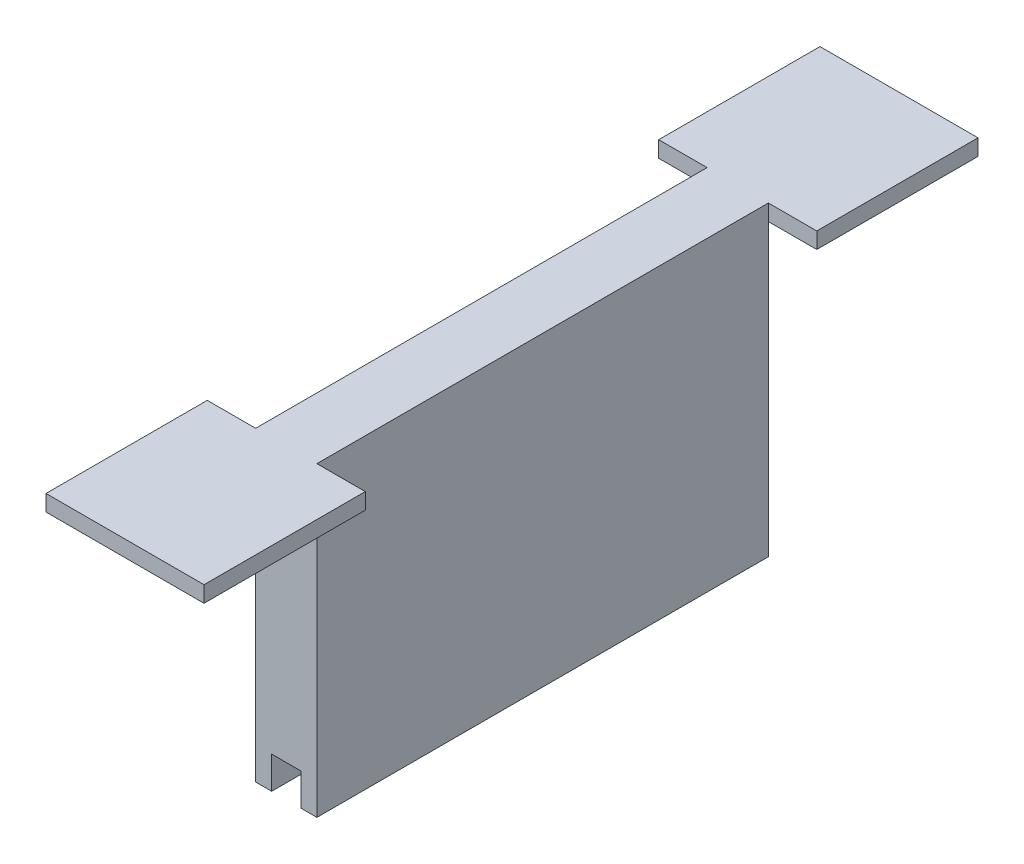
from build123d import *

# Parameters (mm, degrees)
BOSS_EXTRUDE2_DEPTH = 28
SKETCH3_W           = 3.8
SKETCH3_H           = 1
BOSS_EXTRUDE3_DEPTH = 10
SKETCH4_W           = 3.8
SKETCH4_H           = 1
BOSS_EXTRUDE4_DEPTH = 10
SKETCH5_W           = 10
SKETCH5_H           = 1
BOSS_EXTRUDE5_DEPTH = 3
SKETCH6_W           = 10
SKETCH6_H           = 1
BOSS_EXTRUDE6_DEPTH = 3
SKETCH7_W           = 10
SKETCH7_H           = 1
BOSS_EXTRUDE7_DEPTH = 3
SKETCH8_W           = 10
SKETCH8_H           = 1
BOSS_EXTRUDE8_DEPTH = 3


with BuildPart() as part:
    # Sketch1 → Boss-Extrude2 (new body)
    with BuildSketch(Plane.XY):
        Polygon((2.8, 0), (3.8, 0), (3.8, 19), (0, 19), (0, 0), (0.995254582, 0), (0.995254582, 2), (2.8, 2), align=None)
    extrude(amount=BOSS_EXTRUDE2_DEPTH)

    # Sketch3 → Boss-Extrude3 (add)
    with BuildSketch(Plane.XY.offset(28)):
        with Locations((1.9, 18.5)):
            Rectangle(SKETCH3_W, SKETCH3_H)
    extrude(amount=BOSS_EXTRUDE3_DEPTH)

    # Sketch4 → Boss-Extrude4 (add)
    with BuildSketch(Plane(origin=(0, 0, 0), x_dir=(-1, 0, 0), z_dir=(0, 0, -1))):
        with Locations((-1.9, 18.5)):
            Rectangle(SKETCH4_W, SKETCH4_H)
    extrude(amount=BOSS_EXTRUDE4_DEPTH)

    # Sketch5 → Boss-Extrude5 (add)
    with BuildSketch(Plane(origin=(3.8, 0, 0), x_dir=(0, 0, -1), z_dir=(1, 0, 0))):
        with Locations((5, 18.5)):
            Rectangle(SKETCH5_W, SKETCH5_H)
    extrude(amount=BOSS_EXTRUDE5_DEPTH)

    # Sketch6 → Boss-Extrude6 (add)
    with BuildSketch(Plane.ZY):
        with Locations((-5, 18.5)):
            Rectangle(SKETCH6_W, SKETCH6_H)
    extrude(amount=BOSS_EXTRUDE6_DEPTH)

    # Sketch7 → Boss-Extrude7 (add)
    with BuildSketch(Plane.ZY):
        with Locations((33, 18.5)):
            Rectangle(SKETCH7_W, SKETCH7_H)
    extrude(amount=BOSS_EXTRUDE7_DEPTH)

    # Sketch8 → Boss-Extrude8 (add)
    with BuildSketch(Plane(origin=(3.8, 0, 0), x_dir=(0, 0, -1), z_dir=(1, 0, 0))):
        with Locations((-33, 18.5)):
            Rectangle(SKETCH8_W, SKETCH8_H)
    extrude(amount=BOSS_EXTRUDE8_DEPTH)


solid = part.part
